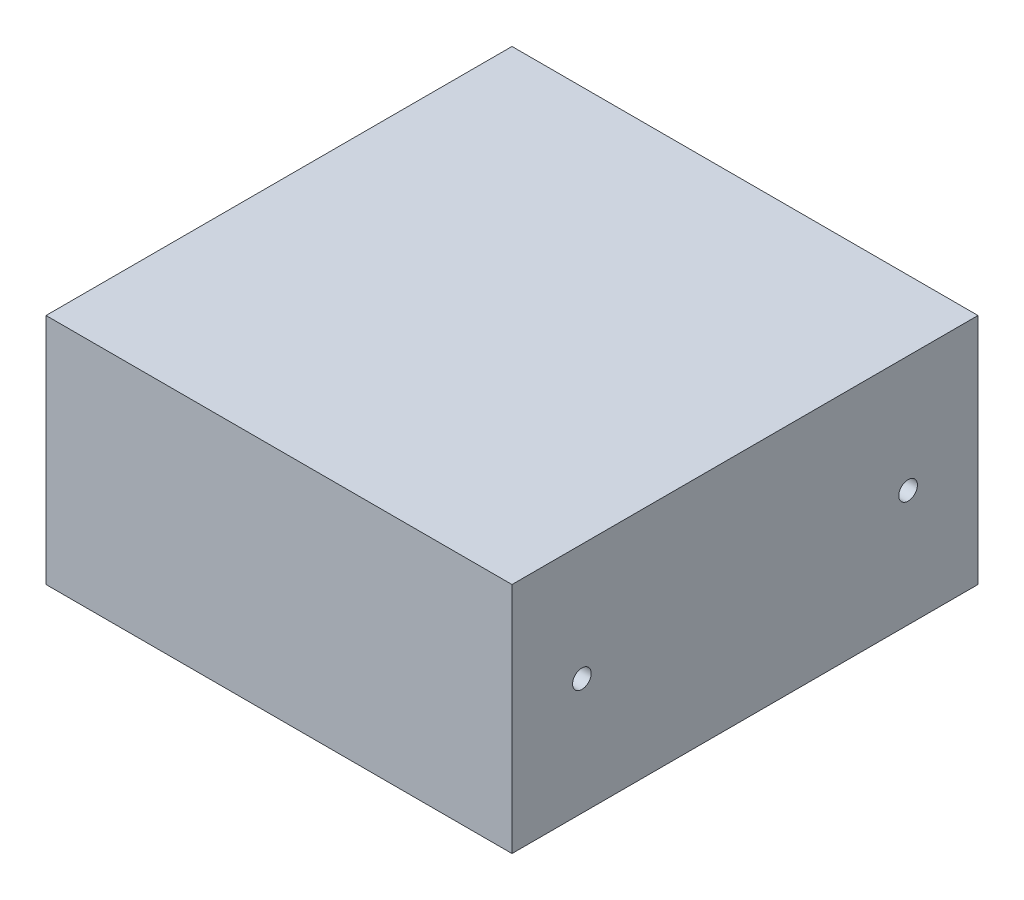
from build123d import *

# Parameters (mm, degrees)
SKETCH1_W           = 100
SKETCH1_H           = 100
BOSS_EXTRUDE1_DEPTH = 50
SKETCH2_R           = 2
CUT_EXTRUDE1_DEPTH  = 10


with BuildPart() as part:
    # Sketch1 → Boss-Extrude1 (new body)
    with BuildSketch(Plane(origin=(0, 0, 0), x_dir=(1, 0, 0), z_dir=(0, 1, 0))):
        with Locations((50, 50)):
            Rectangle(SKETCH1_W, SKETCH1_H)
    extrude(amount=BOSS_EXTRUDE1_DEPTH)

    # Sketch2 → Cut-Extrude1 (cut)
    with BuildSketch(Plane(origin=(100, 0, 0), x_dir=(0, 0, -1), z_dir=(1, 0, 0))):
        with Locations((15, 25)):
            Circle(SKETCH2_R)
        with Locations((85, 25)):
            Circle(SKETCH2_R)
    extrude(amount=-CUT_EXTRUDE1_DEPTH, mode=Mode.SUBTRACT)


solid = part.part
